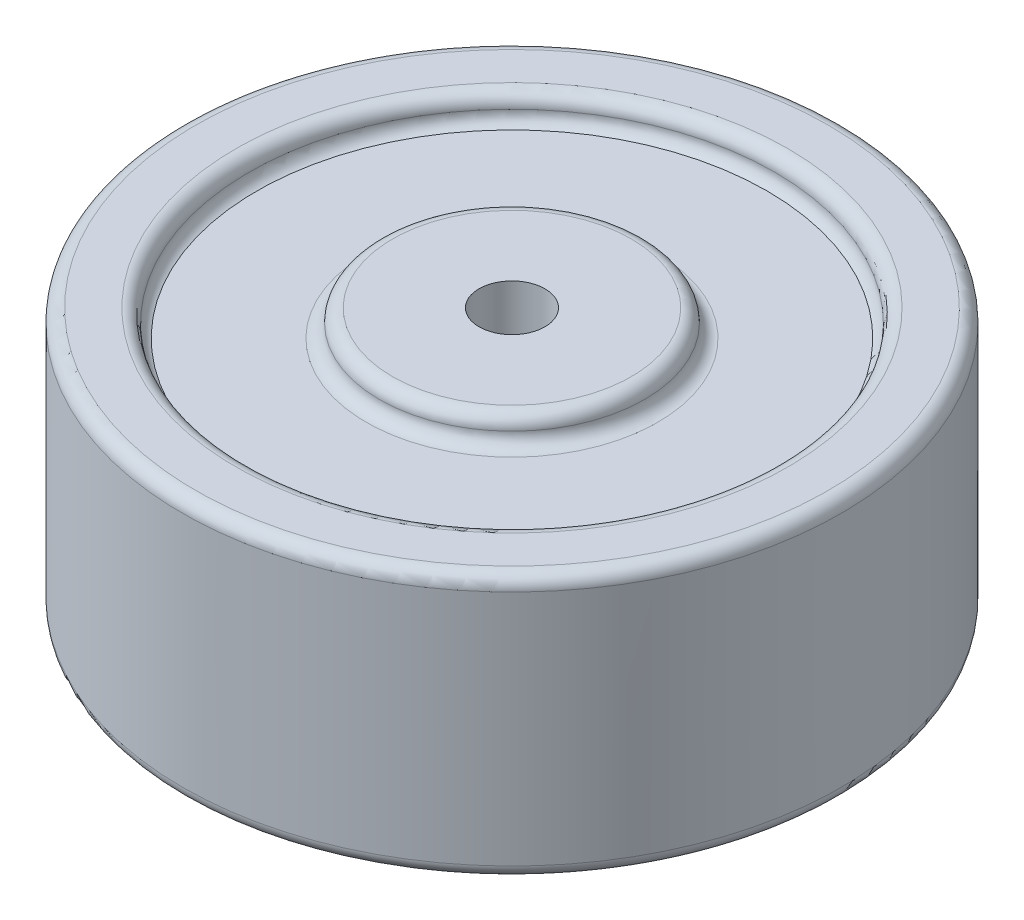
from build123d import *

# Parameters (mm, degrees)
SKETCH3_R          = 2.5
CUT_EXTRUDE2_DEPTH = 20
FILLET2_R          = 1


with BuildPart() as part:
    # Sketch1 → Revolve1 (revolve)
    with BuildSketch(Plane.XY, mode=Mode.PRIVATE) as revolve1_sk:
        with BuildLine():
            Line((0, 0), (-9.055946811, 0))
            ThreePointArc((-9.055946811, 0), (-9.763053592, -0.292893219), (-10.055946811, -1))
            ThreePointArc((-10.055946811, -1), (-10.34884003, -1.707106781), (-11.055946811, -2))
            Line((-11.055946811, -2), (-19.354647336, -2))
            ThreePointArc((-19.354647336, -2), (-19.786534849, -1.610884416), (-19.929010638, -1.047290225))
            ThreePointArc((-19.929010638, -1.047290225), (-20.204258557, -0.309815324), (-20.927891829, 0))
            Line((-20.927891829, 0), (-25, 0))
            Line((-25, 0), (-25, -20))
            Line((-25, -20), (-20.927891829, -20))
            ThreePointArc((-20.927891829, -20), (-20.204258557, -19.690184676), (-19.929010638, -18.952709775))
            ThreePointArc((-19.929010638, -18.952709775), (-19.786534849, -18.389115584), (-19.354647336, -18))
            Line((-19.354647336, -18), (-11.055946811, -18))
            ThreePointArc((-11.055946811, -18), (-10.34884003, -18.292893219), (-10.055946811, -19))
            ThreePointArc((-10.055946811, -19), (-9.763053592, -19.707106781), (-9.055946811, -20))
            Line((-9.055946811, -20), (0, -20))
            Line((0, -20), (0, 0))
        make_face()
    revolve(revolve1_sk.sketch.rotate(Axis((0, 0, 0), (0, 1, 0)), 270), axis=Axis((0, 0, 0), (0, 1, 0)))

    # Sketch3 → Cut-Extrude2 (cut)
    with BuildSketch(Plane.XZ.offset(20)):
        with Locations(Location((0, 0, 0), (0, 0, 270))):
            Circle(SKETCH3_R)
    extrude(amount=-CUT_EXTRUDE2_DEPTH, mode=Mode.SUBTRACT)

    # Fillet2
    fillet2_edges = [part.edges().sort_by_distance(p)[0] for p in [
        (0, -20, 25),
        (0, 0, 25),
    ]]
    fillet(fillet2_edges, radius=FILLET2_R)


solid = part.part
